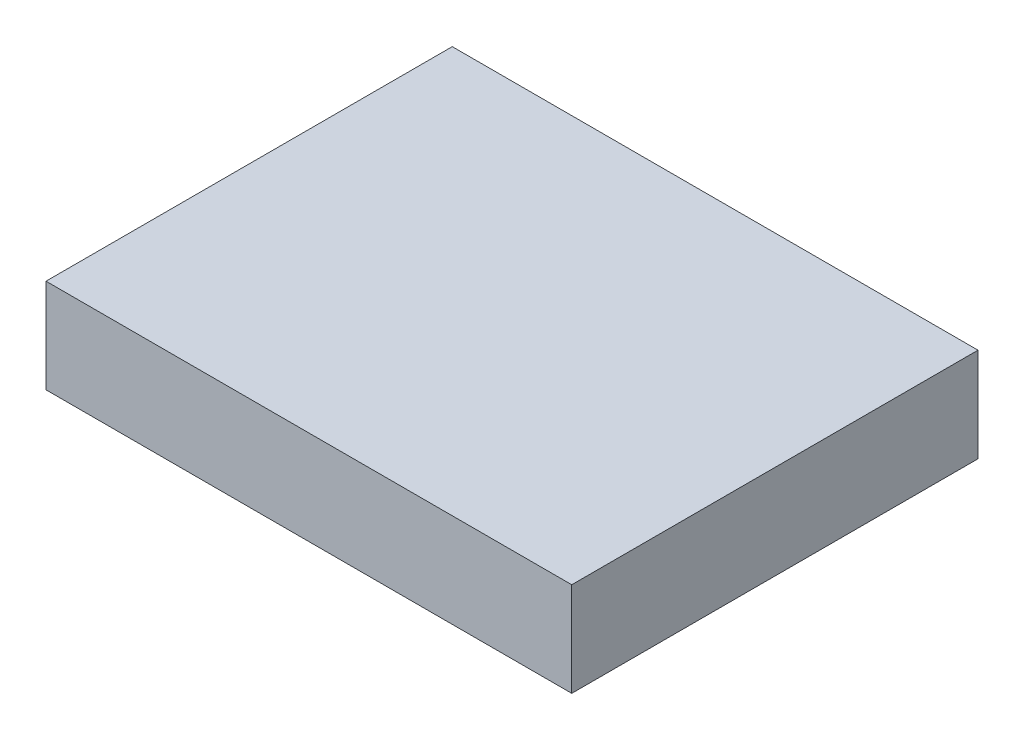
from build123d import *

# Parameters (mm, degrees)
SKETCH1_W           = 279.4
SKETCH1_H           = 215.9
BOSS_EXTRUDE1_DEPTH = 50


with BuildPart() as part:
    # Sketch1 → Boss-Extrude1 (new body)
    with BuildSketch(Plane(origin=(0, 0, 0), x_dir=(1, 0, 0), z_dir=(0, 1, 0))):
        Rectangle(SKETCH1_W, SKETCH1_H)
    extrude(amount=BOSS_EXTRUDE1_DEPTH)


solid = part.part
